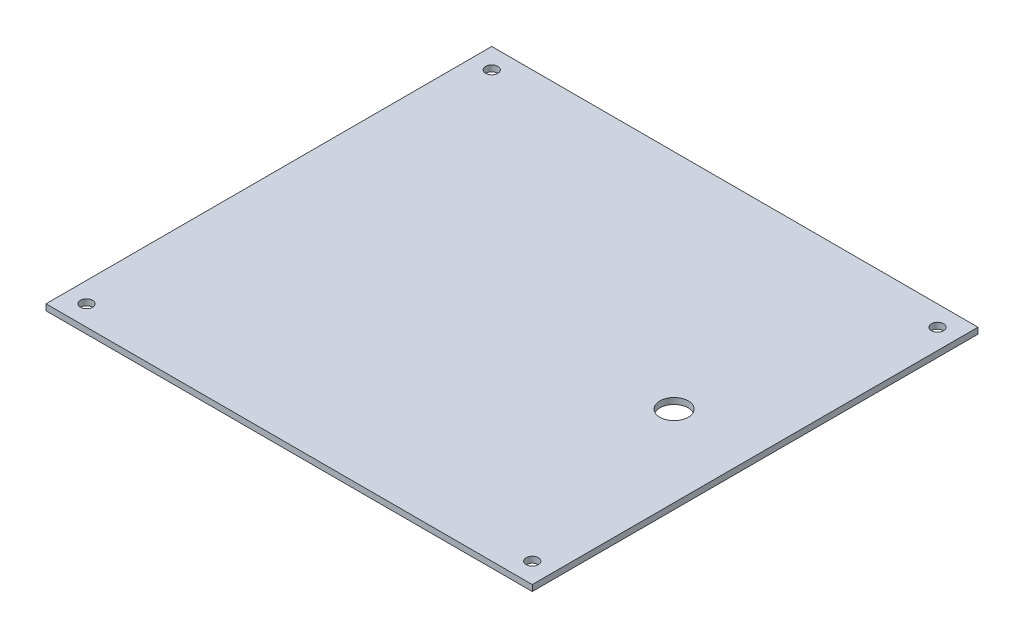
from build123d import *

# Parameters (mm, degrees)
SKETCH1_W           = 120
SKETCH1_H           = 110
SKETCH1_R           = 3.5
SKETCH1_R_2         = 1.5
BOSS_EXTRUDE1_DEPTH = 1.5


with BuildPart() as part:
    # Sketch1 → Boss-Extrude1 (new body)
    with BuildSketch(Plane(origin=(0, 0, 0), x_dir=(1, 0, 0), z_dir=(0, 1, 0))):
        with Locations((60, 55)):
            Rectangle(SKETCH1_W, SKETCH1_H)
        with Locations(Location((100, 55, 0), (0, 0, 270))):
            Circle(SKETCH1_R, mode=Mode.SUBTRACT)
        with Locations(Location((5, 105, 0), (0, 0, 270))):
            Circle(SKETCH1_R_2, mode=Mode.SUBTRACT)
        with Locations(Location((115, 105, 0), (0, 0, 270))):
            Circle(SKETCH1_R_2, mode=Mode.SUBTRACT)
        with Locations(Location((5, 5, 0), (0, 0, 270))):
            Circle(SKETCH1_R_2, mode=Mode.SUBTRACT)
        with Locations(Location((115, 5, 0), (0, 0, 270))):
            Circle(SKETCH1_R_2, mode=Mode.SUBTRACT)
    extrude(amount=BOSS_EXTRUDE1_DEPTH)


solid = part.part
